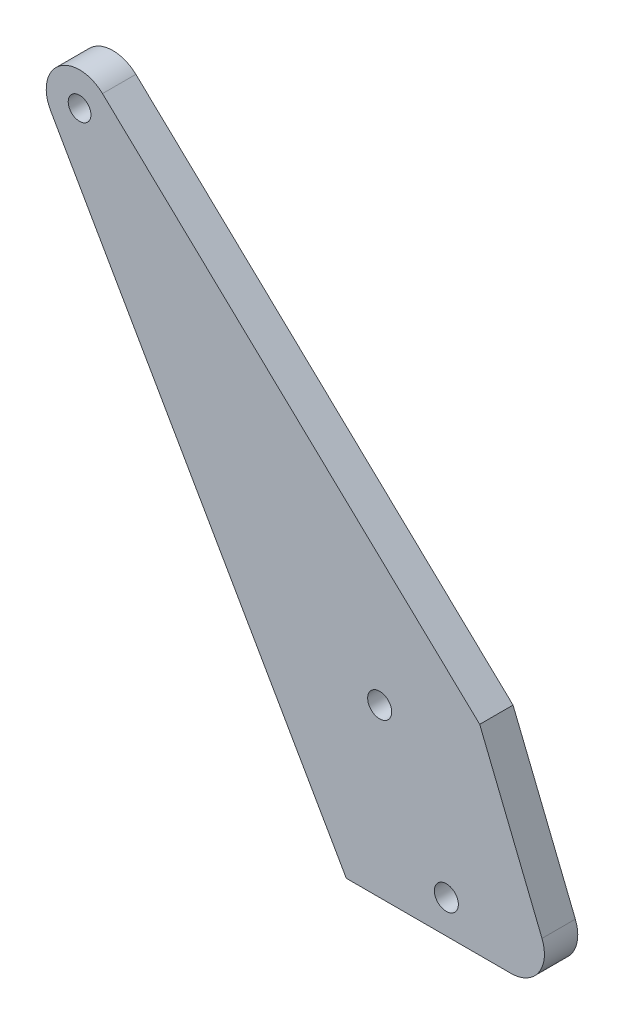
from build123d import *

# Parameters (mm, degrees)
SKETCH1_R           = 2.286
SKETCH1_R_2         = 2.159
BOSS_EXTRUDE1_DEPTH = 6.35
FILLET1_R           = 6.35


with BuildPart() as part:
    # Sketch1 → Boss-Extrude1 (new body)
    with BuildSketch(Plane.XY):
        with BuildLine():
            Line((0, 0), (-25.4, 0))
            Line((-25.4, 0), (-81.711981324, 98.447134338))
            ThreePointArc((-81.711981324, 98.447134338), (-80.122257521, 106.593835794), (-71.830872801, 106.207952639))
            Line((-71.830872801, 106.207952639), (0, 38.1))
            Line((0, 38.1), (15.393399204, 0))
            Line((15.393399204, 0), (0, 0))
        make_face()
        with Locations((-6.35, 6.35)):
            Circle(SKETCH1_R, mode=Mode.SUBTRACT)
        with Locations((-19.05, 31.75)):
            Circle(SKETCH1_R, mode=Mode.SUBTRACT)
        with Locations((-76.2, 101.6)):
            Circle(SKETCH1_R_2, mode=Mode.SUBTRACT)
    extrude(amount=-BOSS_EXTRUDE1_DEPTH)

    # Fillet1
    fillet1_edges = [part.edges().sort_by_distance(p)[0] for p in [
        (15.393399204, 0, -3.175),
    ]]
    fillet(fillet1_edges, radius=FILLET1_R)


solid = part.part
